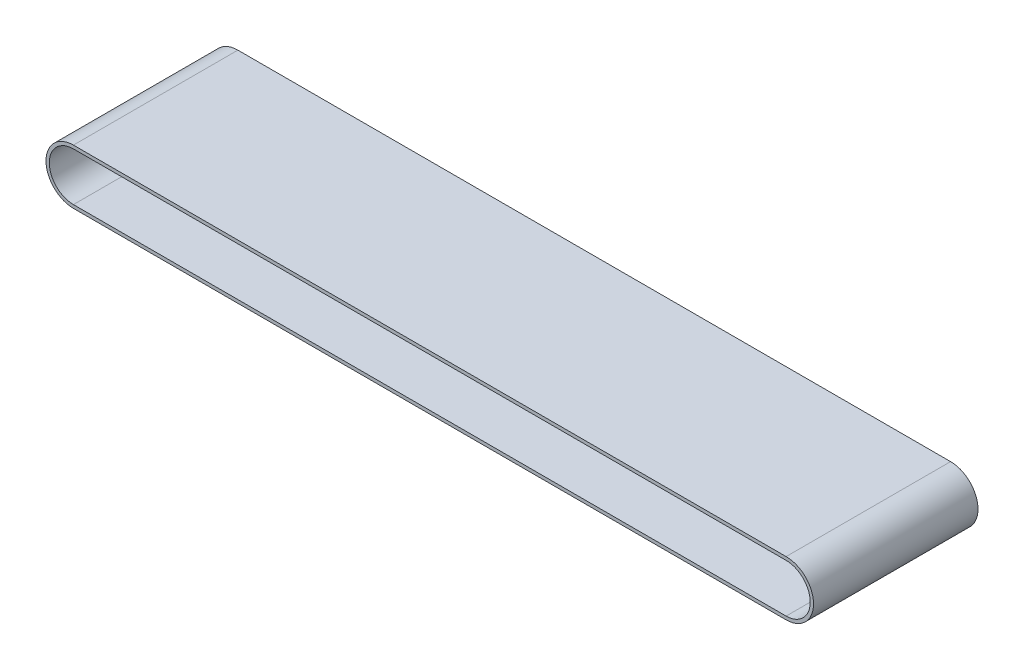
from build123d import *

# Parameters (mm, degrees)
BOSS_EXTRUDE1_DEPTH = 150


with BuildPart() as part:
    # Sketch1 → Boss-Extrude1 (new, symmetric)
    with BuildSketch(Plane.XY):
        with BuildLine():
            Line((0, -50), (1300, -50))
            ThreePointArc((1300, -50), (1350, 0), (1300, 50))
            Line((1300, 50), (0, 50))
            ThreePointArc((0, 50), (-50, 0), (0, -50))
        make_face()
        with BuildLine():
            ThreePointArc((0, 44), (-44, 0), (0, -44))
            Line((0, -44), (1300, -44))
            ThreePointArc((1300, -44), (1344, 0), (1300, 44))
            Line((1300, 44), (0, 44))
        make_face(mode=Mode.SUBTRACT)
    extrude(amount=BOSS_EXTRUDE1_DEPTH, both=True)


solid = part.part
